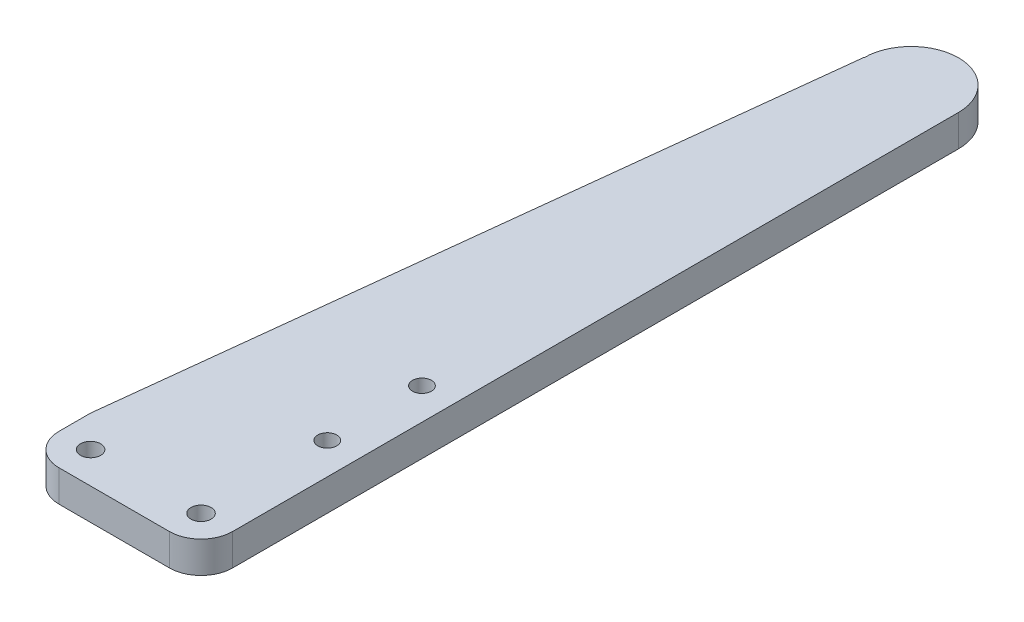
from build123d import *

# Parameters (mm, degrees)
SKETCH_1_R      = 1.6
SKETCH_1_R_2    = 1.5
EXTRUDE_1_DEPTH = 5
FILLET_1_R      = 5


with BuildPart() as part:
    # ｽｹｯﾁ1 → ﾎﾞｽ - 押し出し1 (new body)
    with BuildSketch(Plane(origin=(0, 0, 0), x_dir=(1, 0, 0), z_dir=(0, 1, 0))):
        with BuildLine():
            Line((-13.75, -50), (-13.75, -60))
            Line((-13.75, -60), (13.75, -60))
            Line((13.75, -60), (13.75, 60))
            ThreePointArc((13.75, 60), (6.25, 67.5), (-1.25, 60))
            Line((-1.25, 60), (-1.297901194, 60))
            Line((-1.297901194, 60), (-13.75, -50))
        make_face()
        with Locations(Location((-8.75, -55, 0), (0, 0, 270))):
            Circle(SKETCH_1_R, mode=Mode.SUBTRACT)
        with Locations(Location((8.75, -55, 0), (0, 0, 270))):
            Circle(SKETCH_1_R, mode=Mode.SUBTRACT)
        with Locations(Location((8.75, -35, 0), (0, 0, 270))):
            Circle(SKETCH_1_R_2, mode=Mode.SUBTRACT)
        with Locations(Location((8.75, -20, 0), (0, 0, 270))):
            Circle(SKETCH_1_R_2, mode=Mode.SUBTRACT)
    extrude(amount=EXTRUDE_1_DEPTH)

    # ﾌｨﾚｯﾄ1
    fillet_1_edges = [part.edges().sort_by_distance(p)[0] for p in [
        (13.75, 2.5, 60),
        (-13.75, 2.5, 60),
    ]]
    fillet(fillet_1_edges, radius=FILLET_1_R)


solid = part.part
